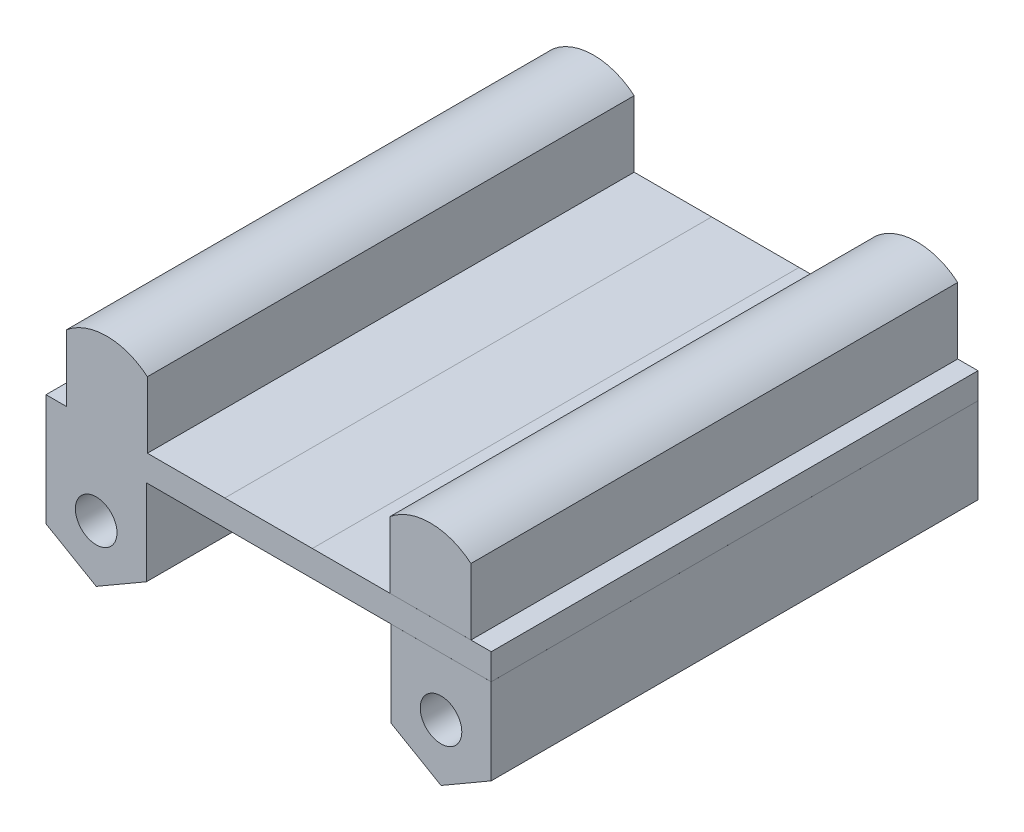
from build123d import *

# Parameters (mm, degrees)
BOSS_EXTRUDE2_DEPTH   = 24
BOSS_EXTRUDE2_2_DEPTH = 24
SKETCH6_R             = 1.025
CUT_EXTRUDE1_DEPTH    = 5
CUT_EXTRUDE2_START    = -5
SKETCH7_R             = 1.025
CUT_EXTRUDE2_DEPTH    = 5
SKETCH8_R             = 0.9
CUT_EXTRUDE3_DEPTH    = 14
CUT_EXTRUDE4_DEPTH    = 24
BOSS_EXTRUDE3_DEPTH   = 24


with BuildPart() as part:
    # Sketch3 → Boss-Extrude2 (new body)
    with BuildSketch(Plane.XY):
        with BuildLine():
            Line((0, 1.284473501), (0, -4.23))
            Line((0, -4.23), (2.475, -5.663169564))
            Line((2.475, -5.663169564), (4.95, -4.23))
            Line((4.95, -4.23), (4.95, 0))
            Line((4.95, 0), (10.974918748, 0))
            Line((10.974918748, 0), (17, -0.000257875))
            Line((17, -0.000257875), (17, 0))
            Line((17, 0), (21.949837505, 0))
            Line((21.949837505, 0), (21.949892461, 1.28400377))
            Line((21.949892461, 1.28400377), (13.928131848, 1.284347104))
            Line((13.928131848, 1.284347104), (13.13155756, 1.284381197))
            Line((13.13155756, 1.284381197), (12.329651428, 1.886055123))
            ThreePointArc((12.329651428, 1.886055123), (12.474649771, 2.499007586), (12.355214929, 3.117449627))
            ThreePointArc((12.355214929, 3.117449627), (10.359172253, 3.897908673), (9.620266793, 1.886113105))
            Line((9.620266793, 1.886113105), (8.81833491, 1.284473501))
            Line((8.81833491, 1.284473501), (0, 1.284473501))
        make_face()
    extrude(amount=BOSS_EXTRUDE2_DEPTH)


with BuildPart() as body_2:
    # Sketch3 → Boss-Extrude2 2 (new body)
    with BuildSketch(Plane.XY):
        Polygon((21.949837485, -0.00046973), (17, -0.000257875), (17, -4.23), (19.475, -5.663169564), (21.95, -4.23), (21.95, 0), (21.949837505, 0), align=None)
    extrude(amount=BOSS_EXTRUDE2_2_DEPTH)


with BuildPart() as cut_extrude1_tool:
    # Sketch6 → Cut-Extrude1 (new body)
    with BuildSketch(Plane.XY.offset(24)):
        with Locations((2.475, -2.863169564)):
            Circle(SKETCH6_R)
        with Locations((19.475, -2.863169564)):
            Circle(SKETCH6_R)
    extrude(amount=-CUT_EXTRUDE1_DEPTH)


with BuildPart() as part_1:
    add(part.part)

    # Cut-Extrude1: cut by cut_extrude1_tool
    add(cut_extrude1_tool.part, mode=Mode.SUBTRACT)


with BuildPart() as body_2_1:
    add(body_2.part)

    # Cut-Extrude1: cut by cut_extrude1_tool
    add(cut_extrude1_tool.part, mode=Mode.SUBTRACT)


with BuildPart() as cut_extrude2_tool:
    # Sketch7 → Cut-Extrude2 (new body)
    with BuildSketch(Plane(origin=(0, 0, 0), x_dir=(-1, 0, 0), z_dir=(0, 0, -1)).offset(CUT_EXTRUDE2_START)):
        with Locations(Location((-19.475, -2.863169564, 0), (0, 0, 180))):
            Circle(SKETCH7_R)
        with Locations(Location((-2.475, -2.863169564, 0), (0, 0, 180))):
            Circle(SKETCH7_R)
    extrude(amount=CUT_EXTRUDE2_DEPTH)


with BuildPart() as part_2:
    add(part_1.part)

    # Cut-Extrude2: cut by cut_extrude2_tool
    add(cut_extrude2_tool.part, mode=Mode.SUBTRACT)


with BuildPart() as body_2_2:
    add(body_2_1.part)

    # Cut-Extrude2: cut by cut_extrude2_tool
    add(cut_extrude2_tool.part, mode=Mode.SUBTRACT)


with BuildPart() as cut_extrude3_tool:
    # Sketch8 → Cut-Extrude3 (new body)
    with BuildSketch(Plane(origin=(0, 0, 5), x_dir=(-1, 0, 0), z_dir=(0, 0, -1))):
        with Locations((-19.475, -2.863169564)):
            Circle(SKETCH8_R)
        with Locations((-2.475, -2.863169564)):
            Circle(SKETCH8_R)
    extrude(amount=-CUT_EXTRUDE3_DEPTH)


with BuildPart() as part_3:
    add(part_2.part)

    # Cut-Extrude3: cut by cut_extrude3_tool
    add(cut_extrude3_tool.part, mode=Mode.SUBTRACT)

    # Sketch9 → Cut-Extrude4 (cut)
    with BuildSketch(Plane.XY.offset(24)):
        Polygon((8.81833491, 1.284473501), (13.13155756, 1.284381197), (13.13155756, 4.431882999), (8.81833491, 4.431882999), align=None)
    extrude(amount=-CUT_EXTRUDE4_DEPTH, mode=Mode.SUBTRACT)

    # Sketch10 → Boss-Extrude3 (add)
    with BuildSketch(Plane.XY.offset(24)):
        with BuildLine():
            Line((0.99983047, 1.284473501), (4.99983047, 1.284473501))
            Line((4.99983047, 1.284473501), (4.99983047, 4.551800372))
            ThreePointArc((4.99983047, 4.551800372), (2.99983047, 5.284473501), (0.99983047, 4.551800372))
            Line((0.99983047, 4.551800372), (0.99983047, 1.284473501))
        make_face()
        with BuildLine():
            Line((20.950061999, 1.284473501), (16.950061999, 1.284473501))
            Line((16.950061999, 1.284473501), (16.950061999, 4.551800372))
            ThreePointArc((16.950061999, 4.551800372), (18.950061999, 5.284473501), (20.950061999, 4.551800372))
            Line((20.950061999, 4.551800372), (20.950061999, 1.284473501))
        make_face()
    extrude(amount=-BOSS_EXTRUDE3_DEPTH)


with BuildPart() as body_2_3:
    add(body_2_2.part)

    # Cut-Extrude3: cut by cut_extrude3_tool
    add(cut_extrude3_tool.part, mode=Mode.SUBTRACT)


with BuildPart() as boss_extrude3_piece_1:
    # of the separate pieces the step leaves, piece 1, a body of its own (boss_extrude3_pieces)
    add(part_3.part.solids().sort_by_distance((8.81833491, 1.284473501, 0))[0])


with BuildPart() as boss_extrude3_piece_2:
    # of the separate pieces the step leaves, piece 2, a body of its own (boss_extrude3_pieces)
    add(part_3.part.solids().sort_by_distance((20.950061999, 1.284473501, 24))[0])


solid = Compound([body_2_3.part, boss_extrude3_piece_1.part, boss_extrude3_piece_2.part])
